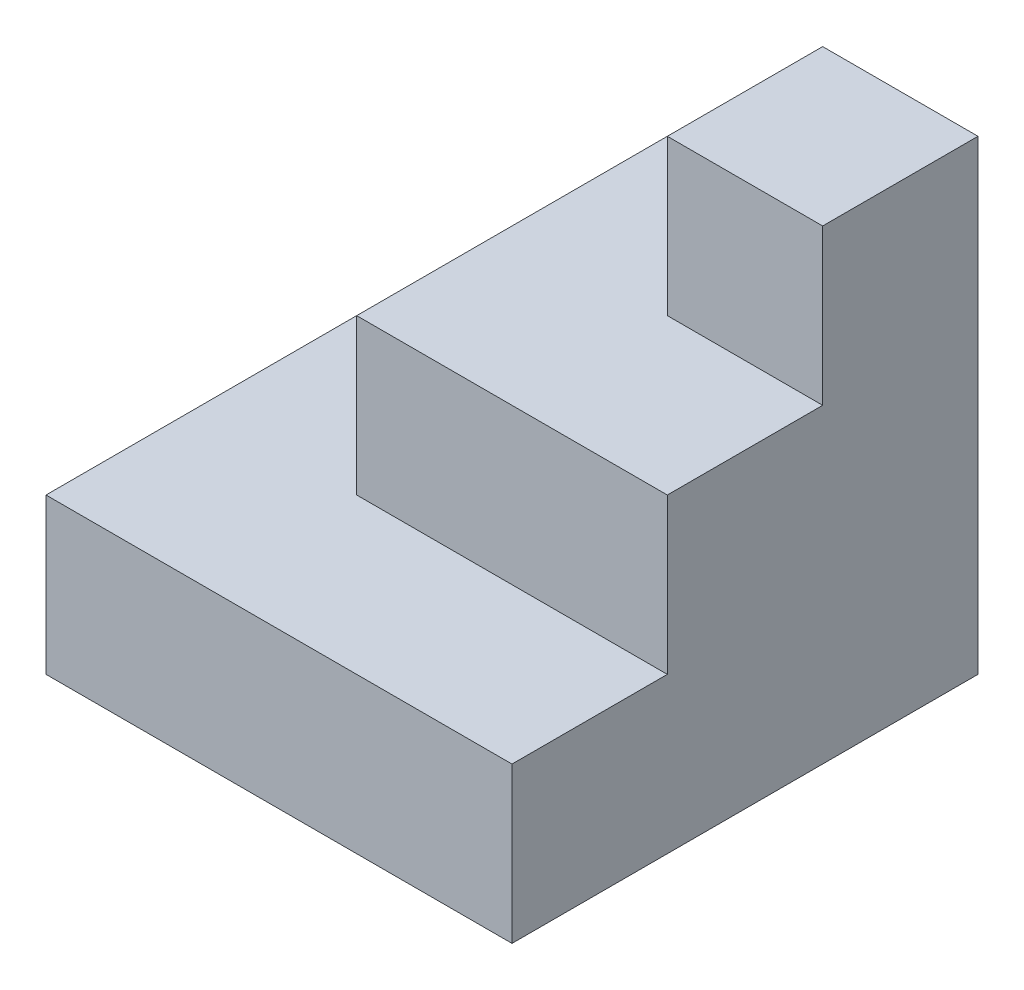
from build123d import *

# Parameters (mm, degrees)
BOSS_EXTRUDE1_DEPTH = 15
SKETCH2_W           = 10
SKETCH2_H           = 5
CUT_EXTRUDE1_DEPTH  = 5
SKETCH3_W           = 5
SKETCH3_H           = 5
CUT_EXTRUDE2_DEPTH  = 10


with BuildPart() as part:
    # Sketch1 → Boss-Extrude1 (new body)
    with BuildSketch(Plane.XY):
        Polygon((0, 0), (0, 15), (-5, 15), (-5, 10), (-10, 10), (-10, 5), (-15, 5), (-15, 0), align=None)
    extrude(amount=BOSS_EXTRUDE1_DEPTH)

    # Sketch2 → Cut-Extrude1 (cut)
    with BuildSketch(Plane.XY.offset(15)):
        with Locations((-5, 7.5)):
            Rectangle(SKETCH2_W, SKETCH2_H)
    extrude(amount=-CUT_EXTRUDE1_DEPTH, mode=Mode.SUBTRACT)

    # Sketch3 → Cut-Extrude2 (cut)
    with BuildSketch(Plane.XY.offset(15)):
        with Locations((-2.5, 12.5)):
            Rectangle(SKETCH3_W, SKETCH3_H)
    extrude(amount=-CUT_EXTRUDE2_DEPTH, mode=Mode.SUBTRACT)


solid = part.part
